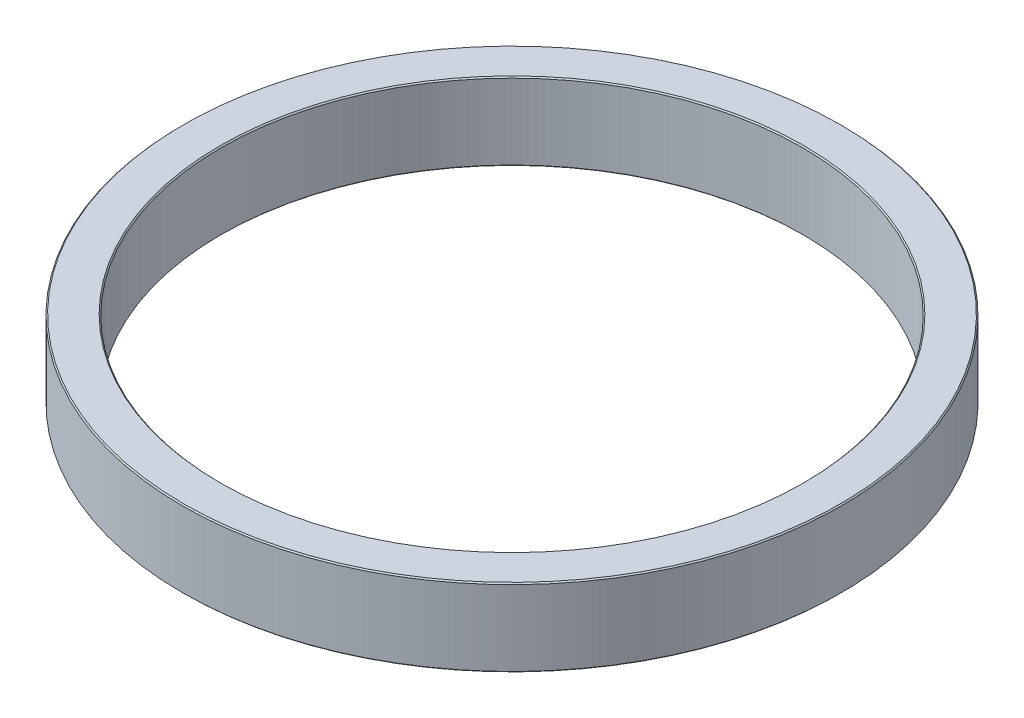
from build123d import *

# Parameters (mm, degrees)
SKETCH1_R           = 42.5
SKETCH1_R_2         = 37.5
BOSS_EXTRUDE1_DEPTH = 10
CHAMFER1_SIZE       = 0.15


with BuildPart() as part:
    # Sketch1 → Boss-Extrude1 (new body)
    with BuildSketch(Plane(origin=(0, 0, 0), x_dir=(1, 0, 0), z_dir=(0, 1, 0))):
        with Locations(Location((0, 0, 0), (0, 0, 270))):
            Circle(SKETCH1_R)
        with Locations(Location((0, 0, 0), (0, 0, 270))):
            Circle(SKETCH1_R_2, mode=Mode.SUBTRACT)
    extrude(amount=BOSS_EXTRUDE1_DEPTH)

    # Chamfer1
    chamfer1_edges = [part.edges().sort_by_distance(p)[0] for p in [
        (0, 0, -42.5),
        (0, 10, -42.5),
        (0, 0, -37.5),
        (0, 10, -37.5),
    ]]
    chamfer(chamfer1_edges, length=CHAMFER1_SIZE)


solid = part.part
